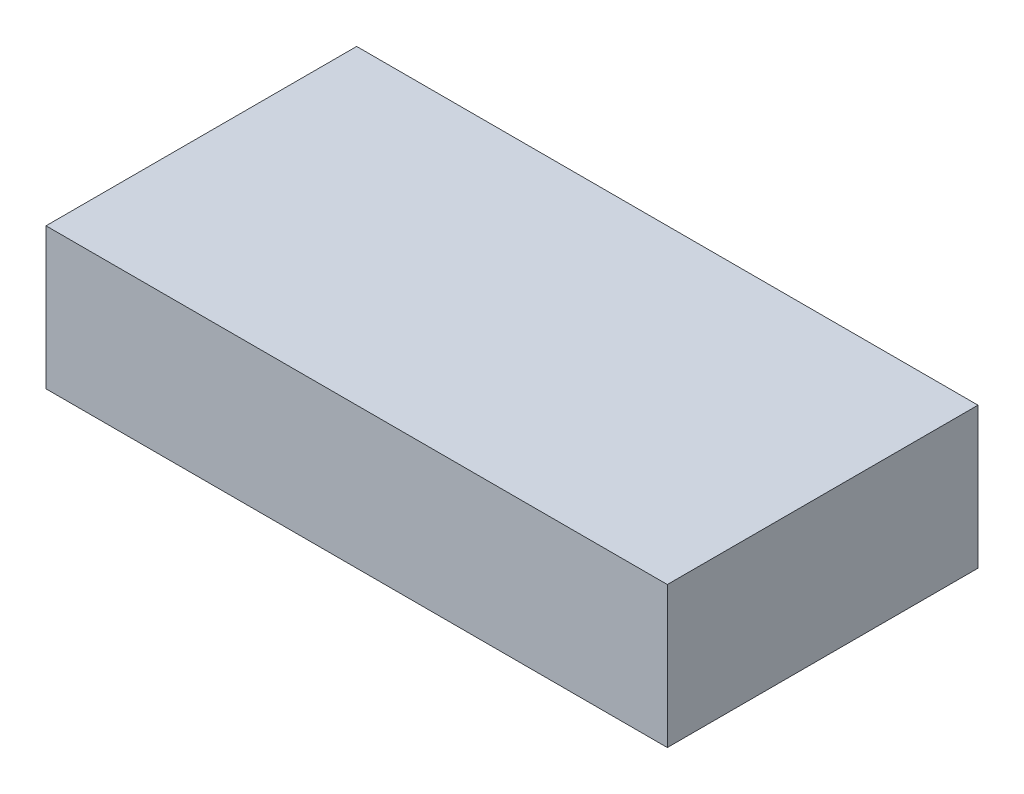
from build123d import *

# Parameters (mm, degrees)
SKETCH_1_W      = 22
SKETCH_1_H      = 11
EXTRUDE_1_DEPTH = 5


with BuildPart() as part:
    # 草图1 → 凸台-拉伸1 (new body)
    with BuildSketch(Plane(origin=(0, 0, 0), x_dir=(1, 0, 0), z_dir=(0, 1, 0))):
        with Locations((1.671568627, -1.401960784)):
            Rectangle(SKETCH_1_W, SKETCH_1_H)
    extrude(amount=EXTRUDE_1_DEPTH)


solid = part.part
